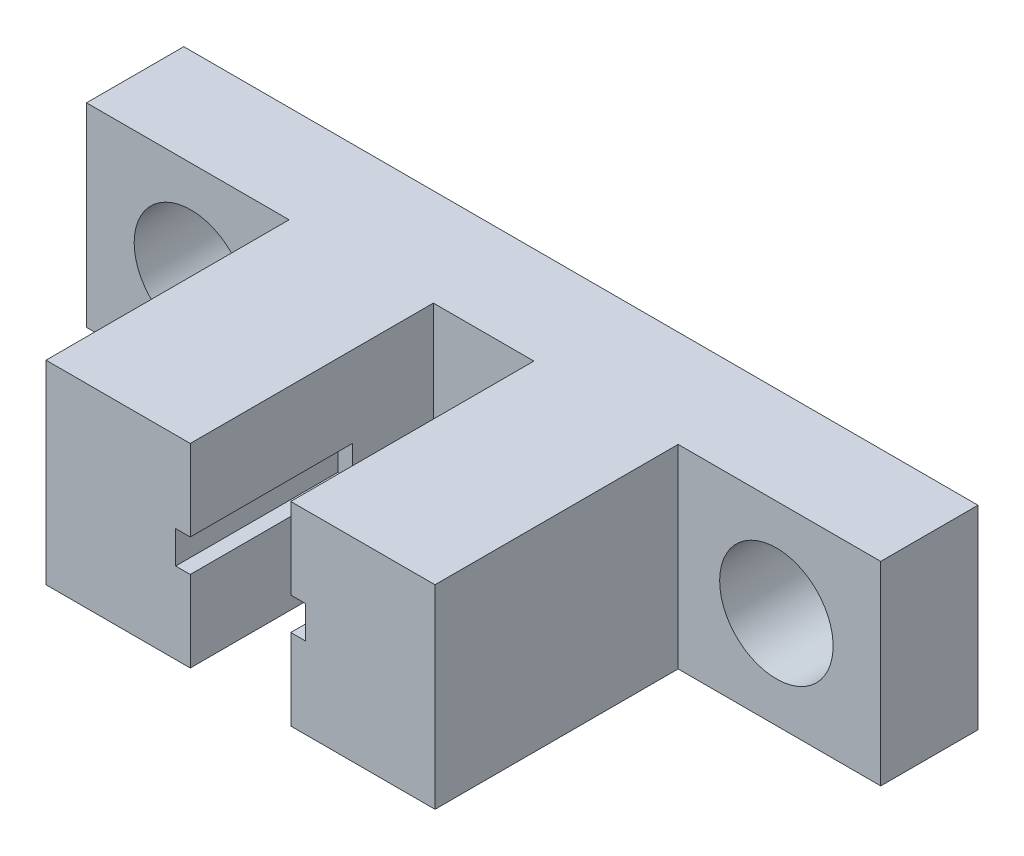
from build123d import *

# Parameters (mm, degrees)
SKETCH1_W             = 4.45
SKETCH1_H             = 6
BOSS_EXTRUDE1_DEPTH   = 7.5
BOSS_EXTRUDE1_2_DEPTH = 7.5
SKETCH2_W             = 6.25
SKETCH2_H             = 6
SKETCH2_R             = 1.75
SKETCH2_W_2           = 4.260679938
SKETCH2_W_3           = 0.189320062
SKETCH2_W_4           = 7.55
BOSS_EXTRUDE2_DEPTH   = 3
SKETCH3_W             = 4
SKETCH3_H             = 1
CUT_EXTRUDE1_DEPTH    = 5


with BuildPart() as part:
    # Sketch1 → Boss-Extrude1 (new body)
    with BuildSketch(Plane.XY):
        with Locations((-3.775, -1.877941176)):
            Rectangle(SKETCH1_W, SKETCH1_H)
    extrude(amount=BOSS_EXTRUDE1_DEPTH)



with BuildPart() as body_2:
    # Sketch1 → Boss-Extrude1 2 (new body)
    with BuildSketch(Plane.XY):
        with Locations((3.775, -1.877941176)):
            Rectangle(SKETCH1_W, SKETCH1_H)
    extrude(amount=BOSS_EXTRUDE1_2_DEPTH)


with BuildPart() as part_1:
    add(part.part)

    add(body_2.part)  # Boss-Extrude2 merges body 2
    # Sketch2 → Boss-Extrude2 (add)
    # profile 1 of 5: a face of its own
    with BuildSketch(Plane(origin=(0, 0, 0), x_dir=(-1, 0, 0), z_dir=(0, 0, -1))):
        with Locations((-9.125, -1.877941176)):
            Rectangle(SKETCH2_W, SKETCH2_H)
        with Locations((-9.030339969, -1.877941176)):
            Circle(SKETCH2_R, mode=Mode.SUBTRACT)
    # profile 2 of 5: a face of its own
    with BuildSketch(Plane(origin=(0, 0, 0), x_dir=(-1, 0, 0), z_dir=(0, 0, -1))):
        with Locations((-3.680339969, -1.877941176)):
            Rectangle(SKETCH2_W_2, SKETCH2_H)
    # profile 3 of 5: a face of its own
    with BuildSketch(Plane(origin=(0, 0, 0), x_dir=(-1, 0, 0), z_dir=(0, 0, -1))):
        with Locations((-5.905339969, -1.877941176)):
            Rectangle(SKETCH2_W_3, SKETCH2_H)
    # profile 4 of 5: a face of its own
    with BuildSketch(Plane(origin=(0, 0, 0), x_dir=(-1, 0, 0), z_dir=(0, 0, -1))):
        with Locations((2.225, -1.877941176)):
            Rectangle(SKETCH2_W_4, SKETCH2_H)
    # profile 5 of 5: a face of its own
    with BuildSketch(Plane(origin=(0, 0, 0), x_dir=(-1, 0, 0), z_dir=(0, 0, -1))):
        with Locations((9.125, -1.877941176)):
            Rectangle(SKETCH2_W, SKETCH2_H)
        with Locations((9.030339969, -1.877941176)):
            Circle(SKETCH2_R, mode=Mode.SUBTRACT)
    extrude(amount=BOSS_EXTRUDE2_DEPTH)

    # Sketch3 → Cut-Extrude1 (cut)
    with BuildSketch(Plane.XY.offset(7.5)):
        with Locations((0, -1.877941176)):
            Rectangle(SKETCH3_W, SKETCH3_H)
    extrude(amount=-CUT_EXTRUDE1_DEPTH, mode=Mode.SUBTRACT)


solid = part_1.part
